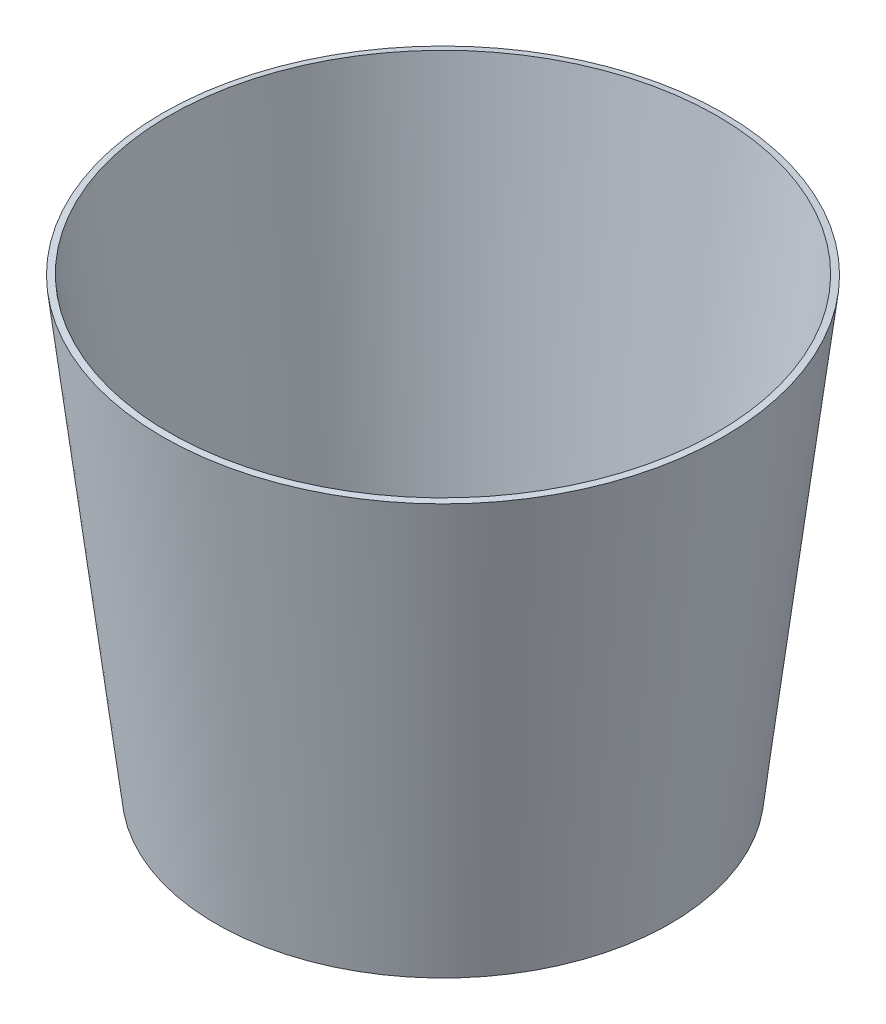
from build123d import *


with BuildPart() as part:
    # 草圖1 → 旋轉1 (revolve)
    with BuildSketch(Plane.XY, mode=Mode.PRIVATE) as revolve_1_sk:
        Polygon((0, 0), (107.664040855, 0), (132.978964823, 212.645361331), (130, 213), (105, 3), (0, 3), align=None)
    revolve(revolve_1_sk.sketch.rotate(Axis((0, 0, 0), (0, 1, 0)), 90), axis=Axis((0, 0, 0), (0, 1, 0)))


solid = part.part
